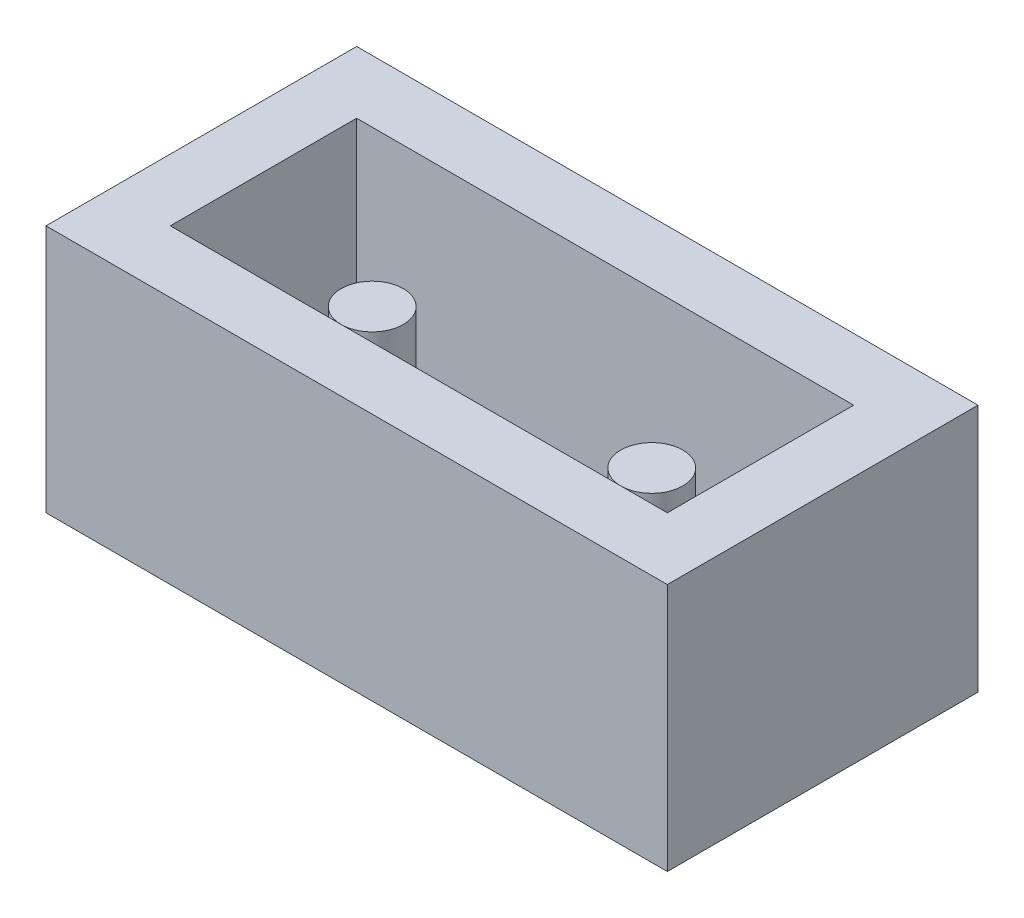
from build123d import *

# Parameters (mm, degrees)
SKETCH_1_W      = 8
SKETCH_1_H      = 3
EXTRUDE_1_DEPTH = 1
SKETCH_2_R      = 0.5
EXTRUDE_2_DEPTH = 3
SKETCH_3_W      = 10
SKETCH_3_H      = 5
SKETCH_3_W_2    = 8
SKETCH_3_H_2    = 3
EXTRUDE_3_DEPTH = 4


with BuildPart() as part:
    # 草图1 → 凸台-拉伸1 (new body)
    with BuildSketch(Plane(origin=(0, 0, 0), x_dir=(1, 0, 0), z_dir=(0, 1, 0))):
        Rectangle(SKETCH_1_W, SKETCH_1_H)
    extrude(amount=EXTRUDE_1_DEPTH)

    # 草图2 → 凸台-拉伸2 (add)
    with BuildSketch(Plane(origin=(0, 1, 0), x_dir=(1, 0, 0), z_dir=(0, 1, 0))):
        with Locations((-2.25, 0)):
            Circle(SKETCH_2_R)
        with Locations((2.25, 0)):
            Circle(SKETCH_2_R)
    extrude(amount=EXTRUDE_2_DEPTH)


with BuildPart() as body_2:
    # 草图3 → 凸台-拉伸3 (new body)
    with BuildSketch(Plane(origin=(0, 1, 0), x_dir=(1, 0, 0), z_dir=(0, 1, 0))):
        Rectangle(SKETCH_3_W, SKETCH_3_H)
        Rectangle(SKETCH_3_W_2, SKETCH_3_H_2, mode=Mode.SUBTRACT)
    extrude(amount=EXTRUDE_3_DEPTH)


solid = Compound([part.part, body_2.part])
